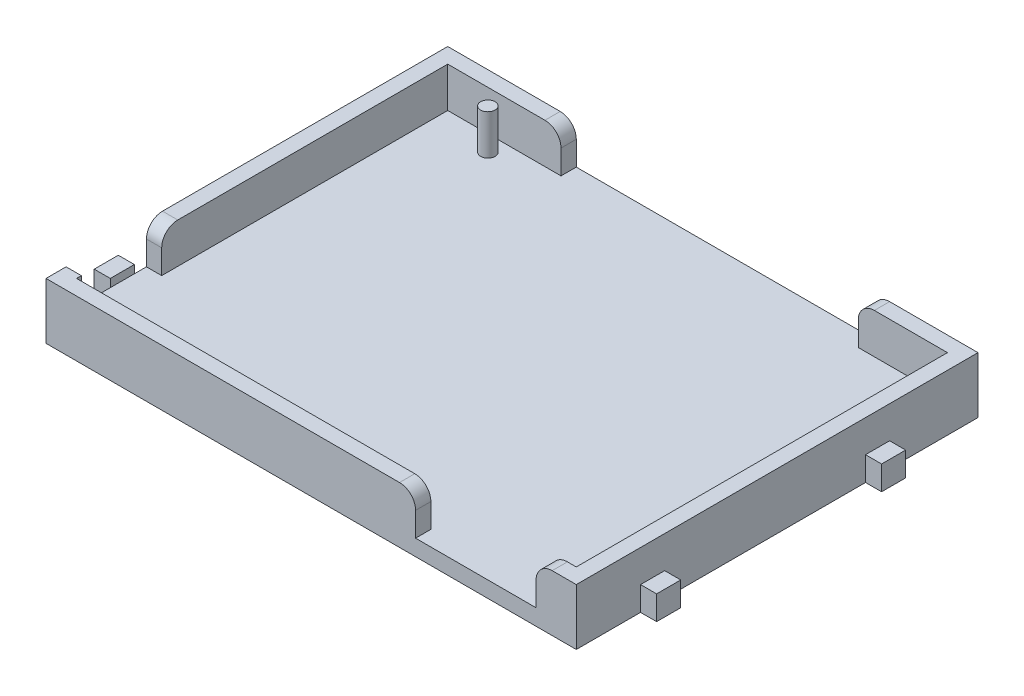
from build123d import *

# Parameters (mm, degrees)
SKETCH_2_W          = 66
SKETCH_2_H          = 50
EXTRUDE_1_DEPTH     = 2
SKETCH_3_W          = 66
SKETCH_3_H          = 50
SKETCH_3_W_2        = 62.2
SKETCH_3_H_2        = 46.2
EXTRUDE_2_DEPTH     = 5
SKETCH_4_W          = 37
SKETCH_4_H          = 6.241197807
CUT_EXTRUDE_1_DEPTH = 5
SKETCH_5_R          = 0.9
EXTRUDE_3_DEPTH     = 5
SKETCH_6_W          = 10
SKETCH_6_H          = 5
CUT_EXTRUDE_2_DEPTH = 5
SKETCH_7_W          = 15
SKETCH_7_H          = 5
CUT_EXTRUDE_3_DEPTH = 5
FILLET_1_R          = 2
SKETCH_8_W          = 3
SKETCH_8_H          = 3
EXTRUDE_4_DEPTH     = 2


with BuildPart() as part:
    # 草图2 → 凸台-拉伸1 (new body)
    with BuildSketch(Plane(origin=(0, 0, 0), x_dir=(1, 0, 0), z_dir=(0, 1, 0))):
        Rectangle(SKETCH_2_W, SKETCH_2_H)
    extrude(amount=EXTRUDE_1_DEPTH)

    # 草图3 → 凸台-拉伸2 (add)
    with BuildSketch(Plane(origin=(0, 2, 0), x_dir=(1, 0, 0), z_dir=(0, 1, 0))):
        Rectangle(SKETCH_3_W, SKETCH_3_H)
        Rectangle(SKETCH_3_W_2, SKETCH_3_H_2, mode=Mode.SUBTRACT)
    extrude(amount=EXTRUDE_2_DEPTH)

    # 草图4 → 切除-拉伸1 (cut)
    with BuildSketch(Plane(origin=(0, 7, 0), x_dir=(1, 0, 0), z_dir=(0, 1, 0))):
        with Locations((1.5, 25.15912339)):
            Rectangle(SKETCH_4_W, SKETCH_4_H)
    extrude(amount=-CUT_EXTRUDE_1_DEPTH, mode=Mode.SUBTRACT)

    # 草图5 → 凸台-拉伸3 (add)
    with BuildSketch(Plane(origin=(0, 2, 0), x_dir=(1, 0, 0), z_dir=(0, 1, 0))):
        with Locations(Location((-24.1, 21.1, 0), (0, 0, 270))):
            Circle(SKETCH_5_R)
    extrude(amount=EXTRUDE_3_DEPTH)

    # 草图6 → 切除-拉伸2 (cut)
    with BuildSketch(Plane.ZY.offset(33)):
        with Locations((17.5, 4.5)):
            Rectangle(SKETCH_6_W, SKETCH_6_H)
    extrude(amount=-CUT_EXTRUDE_2_DEPTH, mode=Mode.SUBTRACT)

    # 草图7 → 切除-拉伸3 (cut)
    with BuildSketch(Plane.XY.offset(25)):
        with Locations((20.5, 4.5)):
            Rectangle(SKETCH_7_W, SKETCH_7_H)
    extrude(amount=-CUT_EXTRUDE_3_DEPTH, mode=Mode.SUBTRACT)

    # 圆角1
    fillet_1_edges = [part.edges().sort_by_distance(p)[0] for p in [
        (13, 7, 24.05),
        (28, 7, 24.05),
        (-17, 7, -24.05),
        (20, 7, -24.05),
        (-32.05, 7, 12.5),
    ]]
    fillet(fillet_1_edges, radius=FILLET_1_R)

    # 草图8 → 凸台-拉伸4 (add)
    with BuildSketch(Plane(origin=(33, 0, 0), x_dir=(0, 0, -1), z_dir=(1, 0, 0))):
        with Locations((-15.5, 1.5)):
            Rectangle(SKETCH_8_W, SKETCH_8_H)
        with Locations((12.5, 1.5)):
            Rectangle(SKETCH_8_W, SKETCH_8_H)
    extrude_4 = extrude(amount=EXTRUDE_4_DEPTH)

    # 镜向1: 凸台-拉伸4 across plane
    add(extrude_4.mirror(Plane(origin=(0, 0, 0), x_dir=(0, 0, 1), z_dir=(1, 0, 0))))


solid = part.part
